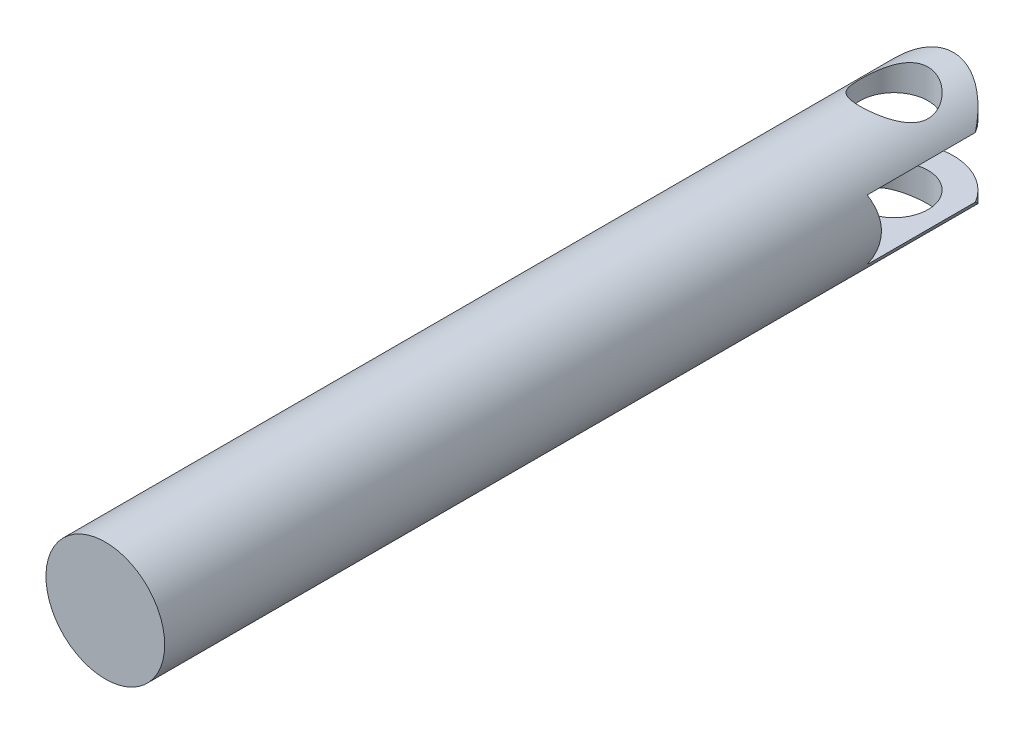
from build123d import *

# Parameters (mm, degrees)
SKETCH_2_R          = 7
EXTRUDE_1_DEPTH     = 100
CUT_EXTRUDE_3_DEPTH = 8
SKETCH_6_R          = 11
CUT_EXTRUDE_5_DEPTH = 3.55
SKETCH_5_R          = 4.01
CUT_EXTRUDE_6_DEPTH = 80


with BuildPart() as part:
    # 草图2 → 凸台-拉伸1 (new body)
    with BuildSketch(Plane.XY):
        Circle(SKETCH_2_R)
    extrude(amount=EXTRUDE_1_DEPTH)

    # 草图3 → 切除-拉伸3 (cut, symmetric)
    with BuildSketch(Plane(origin=(0, 0, 0), x_dir=(1, 0, 0), z_dir=(0, 1, 0))):
        with BuildLine():
            ThreePointArc((-7, -7), (0, 0), (7, -7))
            Line((7, -7), (17.530133207, -7))
            ThreePointArc((17.530133207, -7), (0, 10.530133207), (-17.530133207, -7))
            Line((-17.530133207, -7), (-7, -7))
        make_face()
    extrude(amount=CUT_EXTRUDE_3_DEPTH, both=True, mode=Mode.SUBTRACT)

    # 草图6 → 切除-拉伸5 (cut, symmetric)
    with BuildSketch(Plane(origin=(0, 0, 0), x_dir=(1, 0, 0), z_dir=(0, 1, 0))):
        with Locations((0, -7)):
            Circle(SKETCH_6_R)
    extrude(amount=CUT_EXTRUDE_5_DEPTH, both=True, mode=Mode.SUBTRACT)

    # 草图5 → 切除-拉伸6 (cut, symmetric)
    with BuildSketch(Plane(origin=(0, 0, 0), x_dir=(1, 0, 0), z_dir=(0, 1, 0))):
        with Locations(Location((0, -7, 0), (0, 0, 270))):
            Circle(SKETCH_5_R)
    extrude(amount=CUT_EXTRUDE_6_DEPTH, both=True, mode=Mode.SUBTRACT)


solid = part.part
